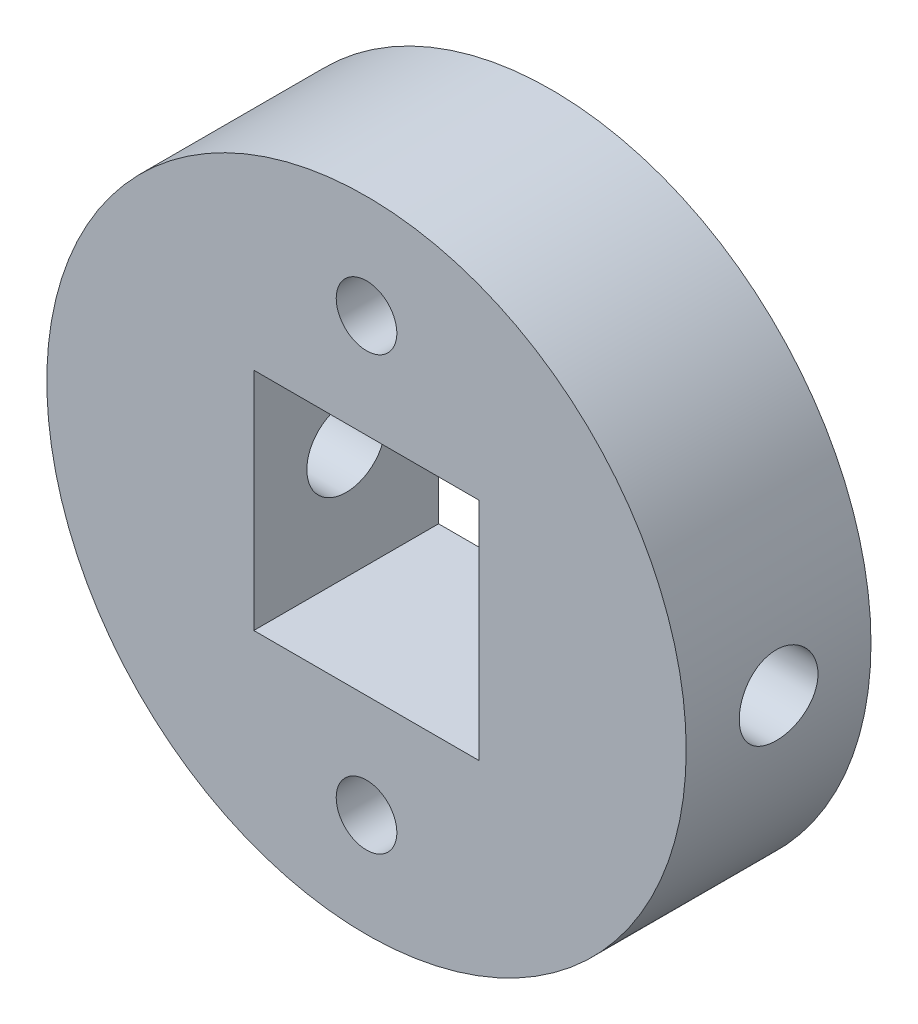
from build123d import *

# Parameters (mm, degrees)
SKETCH1_R                           = 10.9855
SKETCH1_W                           = 7.747
SKETCH1_H                           = 7.747
BOSS_EXTRUDE1_DEPTH                 = 6.35
F_6_32_TAPPED_HOLE1_D               = 2.7051
F_6_32_TAPPED_HOLE1_DEPTH           = 7.112
F_6_32_TAPPED_HOLE1_ON_FACE_2_D     = 2.7051
F_6_32_TAPPED_HOLE1_ON_FACE_2_DEPTH = 7.112
F_6_32_TAPPED_HOLE2_D               = 2.7051
F_45_0_082_DIAMETER_HOLE1_D         = 2.0828


with BuildPart() as part:
    # Sketch1 → Boss-Extrude1 (new body)
    with BuildSketch(Plane.XY):
        Circle(SKETCH1_R)
        Rectangle(SKETCH1_W, SKETCH1_H, mode=Mode.SUBTRACT)
    extrude(amount=BOSS_EXTRUDE1_DEPTH)

    # #6-32 Tapped Hole1
    with Locations(Plane(origin=(10.9855, 0, 3.175), x_dir=(0, 0, 1), z_dir=(1, 0, 0))):
        with Locations((0, 0)):
            Hole(F_6_32_TAPPED_HOLE1_D / 2, depth=F_6_32_TAPPED_HOLE1_DEPTH)

    # #6-32 Tapped Hole1 on face 2
    with Locations(Plane(origin=(3.8735, 0, 3.175), x_dir=(0, 0, -1), z_dir=(-1, 0, 0))):
        with Locations((0, 0)):
            Hole(F_6_32_TAPPED_HOLE1_ON_FACE_2_D / 2, depth=F_6_32_TAPPED_HOLE1_ON_FACE_2_DEPTH)

    # #6-32 Tapped Hole2 (through all)
    with Locations(Plane(origin=(-3.8735, 0, 0), x_dir=(0, 0, -1), z_dir=(1, 0, 0))):
        with Locations((-3.175, 0)):
            Hole(F_6_32_TAPPED_HOLE2_D / 2)

    # #45 (0.082) Diameter Hole1 (through all)
    with Locations(Plane(origin=(0, 0, 0), x_dir=(-1, 0, 0), z_dir=(0, 0, -1))):
        with Locations((0, -7.4295), (0, 7.4295)):
            Hole(F_45_0_082_DIAMETER_HOLE1_D / 2)


solid = part.part
